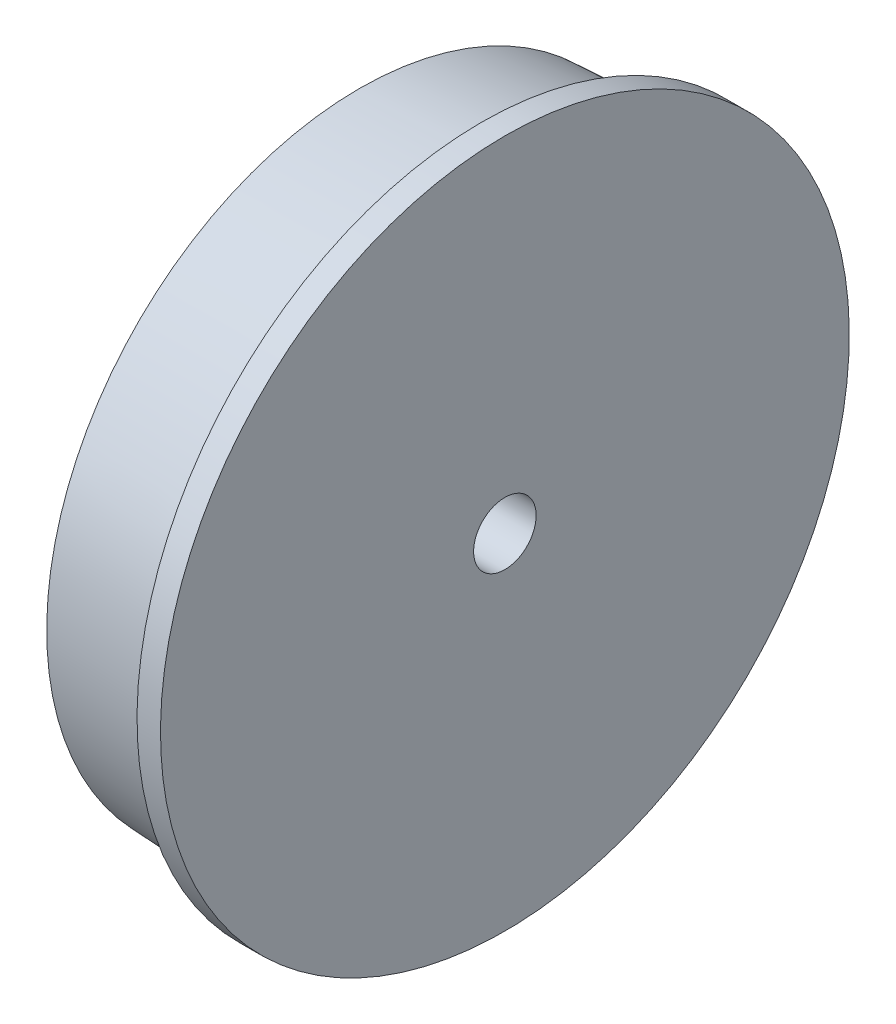
from build123d import *

# Parameters (mm, degrees)
SKETCH2_R           = 20
CUT_EXTRUDE1_DEPTH  = 299.977701101
SKETCH3_R           = 220.25163117
SKETCH3_R_2         = 20
BOSS_EXTRUDE1_DEPTH = 15


with BuildPart() as part:
    # Sketch1 → Revolve1 (revolve)
    with BuildSketch(Plane.XY):
        Polygon((0, 0), (-78, 0), (-78, 200), (0, 204.087806784), align=None)
    revolve(axis=Axis((0, 0, 0), (-1, 0, 0)))

    # Sketch2 → Cut-Extrude1 (cut, through all)
    with BuildSketch(Plane.ZY.offset(78)):
        with Locations(Location((0, 0, 0), (0, 0, 270))):
            Circle(SKETCH2_R)
    extrude(amount=-CUT_EXTRUDE1_DEPTH, mode=Mode.SUBTRACT)

    # Sketch3 → Boss-Extrude1 (add)
    with BuildSketch(Plane(origin=(0, 0, 0), x_dir=(0, 0, -1), z_dir=(1, 0, 0))):
        with Locations(Location((0, 0, 0), (0, 0, 90))):
            Circle(SKETCH3_R)
        with Locations(Location((0, 0, 0), (0, 0, 270))):
            Circle(SKETCH3_R_2, mode=Mode.SUBTRACT)
    extrude(amount=BOSS_EXTRUDE1_DEPTH)


solid = part.part
